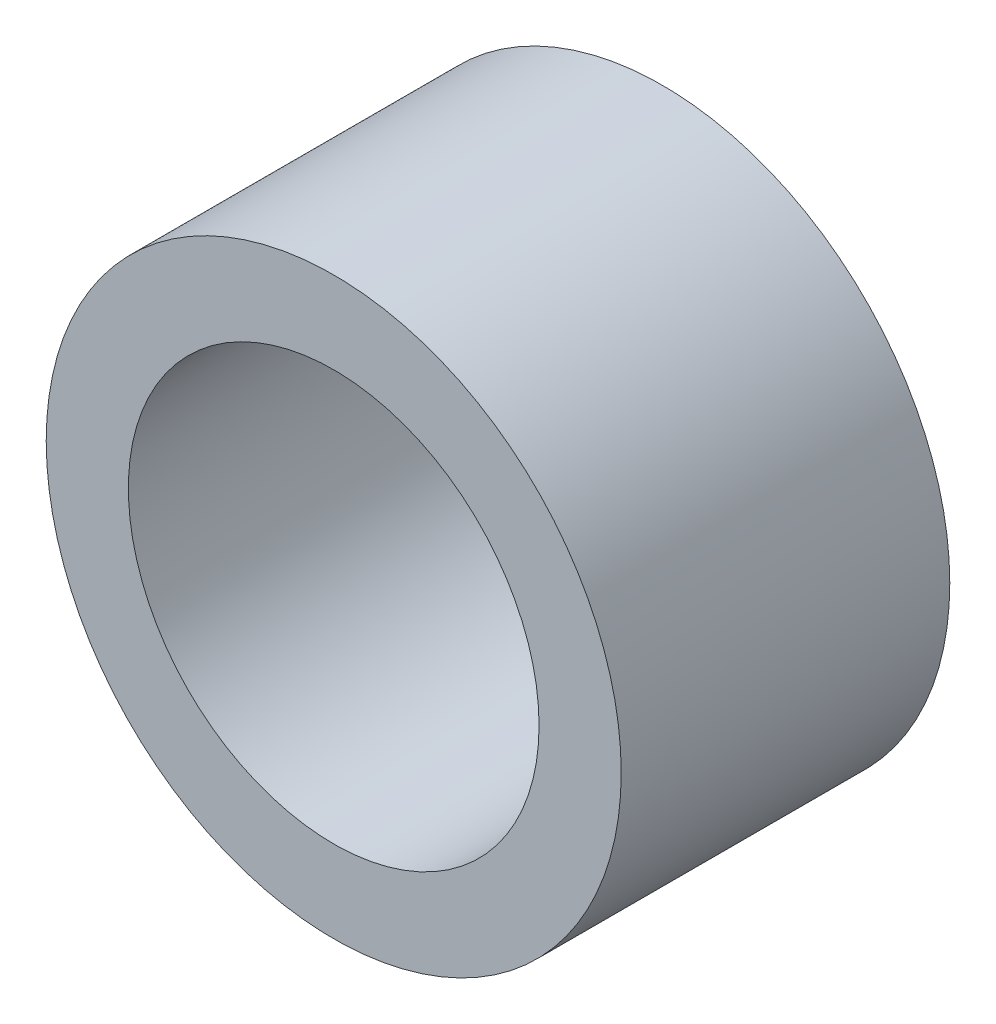
from build123d import *

# Parameters (mm, degrees)
CROQUIS1_R              = 3.5
CROQUIS1_R_2            = 2.5
SALIENTE_EXTRUIR1_DEPTH = 4


with BuildPart() as part:
    # Croquis1 → Saliente-Extruir1 (new body)
    with BuildSketch(Plane.XY):
        Circle(CROQUIS1_R)
        Circle(CROQUIS1_R_2, mode=Mode.SUBTRACT)
    extrude(amount=SALIENTE_EXTRUIR1_DEPTH)


solid = part.part
